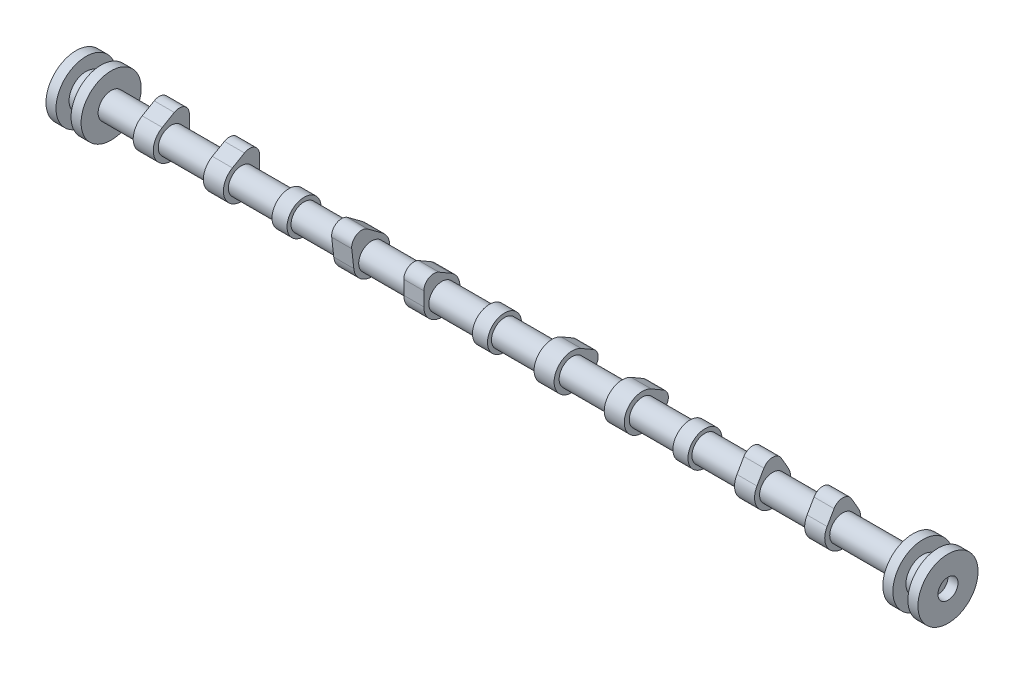
from build123d import *

# Parameters (mm, degrees)
BOSS_EXTRUDE1_DEPTH      = 5
BOSS_EXTRUDE1_DEPTH_BACK = 5
BOSS_EXTRUDE2_DEPTH      = 5
BOSS_EXTRUDE2_DEPTH_BACK = 5
BOSS_EXTRUDE3_DEPTH      = 5
BOSS_EXTRUDE3_DEPTH_BACK = 5
BOSS_EXTRUDE4_DEPTH      = 5
BOSS_EXTRUDE4_DEPTH_BACK = 5
BOSS_EXTRUDE5_DEPTH      = 5
BOSS_EXTRUDE5_DEPTH_BACK = 5
BOSS_EXTRUDE6_DEPTH      = 5
BOSS_EXTRUDE6_DEPTH_BACK = 5
BOSS_EXTRUDE7_DEPTH      = 5
BOSS_EXTRUDE7_DEPTH_BACK = 5
BOSS_EXTRUDE8_DEPTH      = 5
BOSS_EXTRUDE8_DEPTH_BACK = 5
SKETCH12_R               = 5
CUT_EXTRUDE1_DEPTH       = 5


with BuildPart() as part:
    # Sketch2 → Revolve1 (revolve)
    with BuildSketch(Plane(origin=(0, 0, 0), x_dir=(1, 0, 0), z_dir=(0, 1, 0)), mode=Mode.PRIVATE) as revolve1_sk:
        Polygon((-217.5, 0), (217.5, 0), (217.5, 15), (212.5, 15), (212.5, 8.5), (205, 8.5), (205, 15), (200, 15), (200, 6.5), (96.25, 6.5), (96.25, 8.5), (88.75, 8.5), (88.75, 6.5), (-3.75, 6.5), (-3.75, 8.5), (-11.25, 8.5), (-11.25, 6.5), (-103.75, 6.5), (-103.75, 8.5), (-111.25, 8.5), (-111.25, 6.5), (-200, 6.5), (-200, 15), (-205, 15), (-205, 8.5), (-212.5, 8.5), (-212.5, 15), (-217.5, 15), (-217.5, 6.5), align=None)
    revolve(revolve1_sk.sketch.rotate(Axis((-217.5, 0, 0), (1, 0, 0)), 180), axis=Axis((-217.5, 0, 0), (1, 0, 0)))

    # Sketch4 → Boss-Extrude1 (add, two sides: drawn at the far end of the back side and taken through both)
    with BuildSketch(Plane(origin=(-175, 0, 0), x_dir=(0, 0, -1), z_dir=(1, 0, 0)).offset(-BOSS_EXTRUDE1_DEPTH_BACK)):
        with BuildLine():
            Line((-4.5, 7.794228634), (1.5, 11.258330249))
            ThreePointArc((1.5, 11.258330249), (6.5, 11.258330249), (9, 6.92820323))
            Line((9, 6.92820323), (9, 0))
            ThreePointArc((9, 0), (-4.5, -7.794228634), (-4.5, 7.794228634))
        make_face()
    extrude(amount=BOSS_EXTRUDE1_DEPTH + BOSS_EXTRUDE1_DEPTH_BACK)

    # Sketch5 → Boss-Extrude2 (add, two sides: drawn at the far end of the back side and taken through both)
    with BuildSketch(Plane(origin=(-140, 0, 0), x_dir=(0, 0, -1), z_dir=(1, 0, 0)).offset(-BOSS_EXTRUDE2_DEPTH_BACK)):
        with BuildLine():
            Line((-4.5, 7.794228634), (1.5, 11.258330249))
            ThreePointArc((1.5, 11.258330249), (6.5, 11.258330249), (9, 6.92820323))
            Line((9, 6.92820323), (9, 0))
            ThreePointArc((9, 0), (-4.5, -7.794228634), (-4.5, 7.794228634))
        make_face()
    extrude(amount=BOSS_EXTRUDE2_DEPTH + BOSS_EXTRUDE2_DEPTH_BACK)

    # Sketch6 → Boss-Extrude3 (add, two sides: drawn at the far end of the back side and taken through both)
    with BuildSketch(Plane(origin=(-75, 0, 0), x_dir=(0, 0, -1), z_dir=(1, 0, 0)).offset(-BOSS_EXTRUDE3_DEPTH_BACK)):
        with BuildLine():
            Line((-8.94352854, -1.006626672), (-9.968626967, 8.101016998))
            ThreePointArc((-9.968626967, 8.101016998), (-7.5, 12.990381057), (-2.031373033, 12.683592693))
            Line((-2.031373033, 12.683592693), (5.34352854, 7.242009579))
            ThreePointArc((5.34352854, 7.242009579), (4.5, -7.794228634), (-8.94352854, -1.006626672))
        make_face()
    extrude(amount=BOSS_EXTRUDE3_DEPTH + BOSS_EXTRUDE3_DEPTH_BACK)

    # Sketch7 → Boss-Extrude4 (add, two sides: drawn at the far end of the back side and taken through both)
    with BuildSketch(Plane(origin=(-40, 0, 0), x_dir=(0, 0, -1), z_dir=(1, 0, 0)).offset(-BOSS_EXTRUDE4_DEPTH_BACK)):
        with BuildLine():
            Line((-9, 0), (-9, 6.92820323))
            ThreePointArc((-9, 6.92820323), (-6.5, 11.258330249), (-1.5, 11.258330249))
            Line((-1.5, 11.258330249), (4.5, 7.794228634))
            ThreePointArc((4.5, 7.794228634), (4.5, -7.794228634), (-9, 0))
        make_face()
    extrude(amount=BOSS_EXTRUDE4_DEPTH + BOSS_EXTRUDE4_DEPTH_BACK)

    # Sketch8 → Boss-Extrude5 (add, two sides: drawn at the far end of the back side and taken through both)
    with BuildSketch(Plane(origin=(25, 0, 0), x_dir=(0, 0, -1), z_dir=(1, 0, 0)).offset(-BOSS_EXTRUDE5_DEPTH_BACK)):
        with BuildLine():
            Line((4.5, 7.794228634), (10.5, 4.330127019))
            ThreePointArc((10.5, 4.330127019), (13, 0), (10.5, -4.330127019))
            Line((10.5, -4.330127019), (4.5, -7.794228634))
            ThreePointArc((4.5, -7.794228634), (-9, 0), (4.5, 7.794228634))
        make_face()
    extrude(amount=BOSS_EXTRUDE5_DEPTH + BOSS_EXTRUDE5_DEPTH_BACK)

    # Sketch9 → Boss-Extrude6 (add, two sides: drawn at the far end of the back side and taken through both)
    with BuildSketch(Plane(origin=(60, 0, 0), x_dir=(0, 0, -1), z_dir=(1, 0, 0)).offset(-BOSS_EXTRUDE6_DEPTH_BACK)):
        with BuildLine():
            Line((4.5, 7.794228634), (10.5, 4.330127019))
            ThreePointArc((10.5, 4.330127019), (13, 0), (10.5, -4.330127019))
            Line((10.5, -4.330127019), (4.5, -7.794228634))
            ThreePointArc((4.5, -7.794228634), (-9, 0), (4.5, 7.794228634))
        make_face()
    extrude(amount=BOSS_EXTRUDE6_DEPTH + BOSS_EXTRUDE6_DEPTH_BACK)

    # Sketch10 → Boss-Extrude7 (add, two sides: drawn at the far end of the back side and taken through both)
    with BuildSketch(Plane(origin=(125, 0, 0), x_dir=(0, 0, -1), z_dir=(1, 0, 0)).offset(-BOSS_EXTRUDE7_DEPTH_BACK)):
        with BuildLine():
            Line((-7.794228634, 4.5), (-4.330127019, 10.5))
            ThreePointArc((-4.330127019, 10.5), (0, 13), (4.330127019, 10.5))
            Line((4.330127019, 10.5), (7.794228634, 4.5))
            ThreePointArc((7.794228634, 4.5), (0, -9), (-7.794228634, 4.5))
        make_face()
    extrude(amount=BOSS_EXTRUDE7_DEPTH + BOSS_EXTRUDE7_DEPTH_BACK)

    # Sketch11 → Boss-Extrude8 (add, two sides: drawn at the far end of the back side and taken through both)
    with BuildSketch(Plane(origin=(160, 0, 0), x_dir=(0, 0, -1), z_dir=(1, 0, 0)).offset(-BOSS_EXTRUDE8_DEPTH_BACK)):
        with BuildLine():
            Line((-7.794228634, 4.5), (-4.330127019, 10.5))
            ThreePointArc((-4.330127019, 10.5), (0, 13), (4.330127019, 10.5))
            Line((4.330127019, 10.5), (7.794228634, 4.5))
            ThreePointArc((7.794228634, 4.5), (0, -9), (-7.794228634, 4.5))
        make_face()
    extrude(amount=BOSS_EXTRUDE8_DEPTH + BOSS_EXTRUDE8_DEPTH_BACK)

    # Sketch12 → Cut-Extrude1 (cut)
    with BuildSketch(Plane.ZY.offset(217.5)):
        Circle(SKETCH12_R)
    cut_extrude1 = extrude(amount=-CUT_EXTRUDE1_DEPTH, mode=Mode.SUBTRACT)

    # Mirror1: Cut-Extrude1 across plane
    add(cut_extrude1.mirror(Plane(origin=(0, 0, 0), x_dir=(0, 0, 1), z_dir=(1, 0, 0))), mode=Mode.SUBTRACT)


solid = part.part
